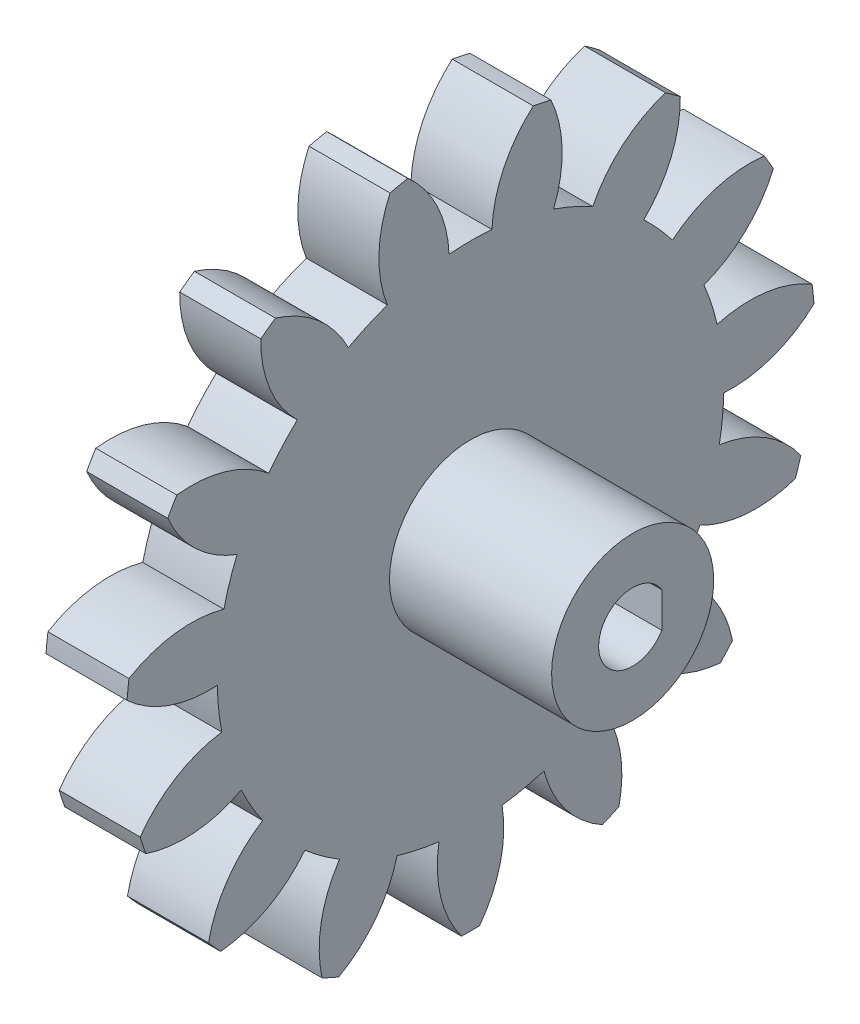
from build123d import *

# Parameters (mm, degrees)
BASPROSKE_W         = 6.35
BASPROSKE_H         = 26.9875
TOOTHCUT_DEPTH      = 39.690732902
TEETHCUTS_COUNT     = 15
BORSKE_R            = 1.5875
BORE_DEPTH          = 50.8000508
SKETCH1_R           = 6.35
BOSS_EXTRUDE1_DEPTH = 12.7
CUT_EXTRUDE1_DEPTH  = 43.603765196


with BuildPart() as part:
    # BasProSke → Base-Revolve (revolve)
    with BuildSketch(Plane(origin=(0, 0, 0), x_dir=(1, 0, 0), z_dir=(0, 1, 0)), mode=Mode.PRIVATE) as base_revolve_sk:
        with Locations((3.175, 13.49375)):
            Rectangle(BASPROSKE_W, BASPROSKE_H)
    revolve(base_revolve_sk.sketch.rotate(Axis((-10, 0, 0), (1, 0, 0)), 180), axis=Axis((-10, 0, 0), (1, 0, 0)))

    # TooCutSke → ToothCut (cut, through all)
    with BuildSketch(Plane(origin=(0, 0, 0), x_dir=(0, 0, -1), z_dir=(1, 0, 0))):
        with BuildLine():
            ThreePointArc((1.678565227, 19.771353806), (0, 19.84248), (-1.678565227, 19.771353806))
            ThreePointArc((-1.678565227, 19.771353806), (-2.61022813, 23.500276553), (-4.939797818, 26.557393771))
            ThreePointArc((-4.939797818, 26.557393771), (0, 27.0129), (4.939797818, 26.557393771))
            ThreePointArc((4.939797818, 26.557393771), (2.61022813, 23.500276553), (1.678565227, 19.771353806))
        make_face()
    toothcut = extrude(amount=TOOTHCUT_DEPTH, mode=Mode.SUBTRACT)

    # TeethCuts: ToothCut ×15 about axis
    teethcuts_axis = Axis((0, 0, 0), (1, 0, 0))
    for i in range(1, TEETHCUTS_COUNT):
        add(toothcut.rotate(teethcuts_axis, i * 360 / TEETHCUTS_COUNT), mode=Mode.SUBTRACT)

    # BorSke → Bore (cut, symmetric)
    with BuildSketch(Plane(origin=(0, 0, 0), x_dir=(0, 0, -1), z_dir=(1, 0, 0))):
        with Locations(Location((0, 0, 0), (0, 0, 180))):
            Circle(BORSKE_R)
    extrude(amount=BORE_DEPTH, both=True, mode=Mode.SUBTRACT)

    # Sketch1 → Boss-Extrude1 (add)
    with BuildSketch(Plane(origin=(6.35, 0, 0), x_dir=(0, 0, -1), z_dir=(1, 0, 0))):
        with Locations(Location((0, 0, 0), (0, 0, 180))):
            Circle(SKETCH1_R)
    extrude(amount=BOSS_EXTRUDE1_DEPTH)

    # Sketch2 → Cut-Extrude1 (cut, through all)
    with BuildSketch(Plane(origin=(19.05, 0, 0), x_dir=(0, 0, -1), z_dir=(1, 0, 0))):
        with BuildLine():
            ThreePointArc((2.286, 1.373715036), (1.313238554, 2.321269803), (0, 2.667))
            Line((0, 2.667), (0, 0))
            Line((0, 0), (2.286, 0))
            Line((2.286, 0), (2.286, 1.373715036))
        make_face()
        with BuildLine():
            Line((2.286, 0), (0, 0))
            Line((0, 0), (0, -2.667))
            ThreePointArc((0, -2.667), (1.313238554, -2.321269803), (2.286, -1.373715036))
            Line((2.286, -1.373715036), (2.286, 0))
        make_face()
        with BuildLine():
            Line((0, 0), (0, 2.667))
            ThreePointArc((0, 2.667), (-2.667, 0), (0, -2.667))
            Line((0, -2.667), (0, 0))
        make_face()
        with BuildLine():
            ThreePointArc((2.286, 1.373715036), (1.313238554, 2.321269803), (0, 2.667))
            Line((0, 2.667), (0, 0))
            Line((0, 0), (2.286, 0))
            Line((2.286, 0), (2.286, 1.373715036))
        make_face()
        with BuildLine():
            Line((2.286, 0), (0, 0))
            Line((0, 0), (0, -2.667))
            ThreePointArc((0, -2.667), (1.313238554, -2.321269803), (2.286, -1.373715036))
            Line((2.286, -1.373715036), (2.286, 0))
        make_face()
    extrude(amount=-CUT_EXTRUDE1_DEPTH, mode=Mode.SUBTRACT)


solid = part.part
